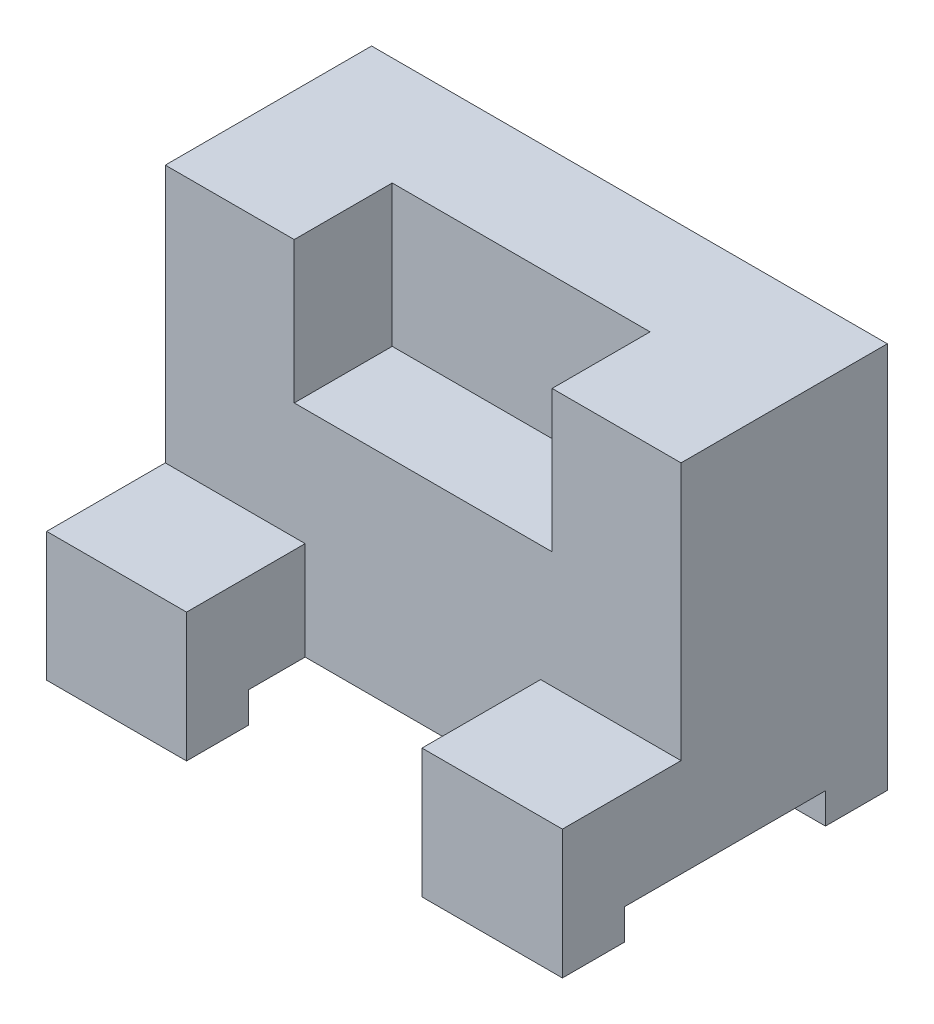
from build123d import *

# Parameters (mm, degrees)
SKETCH1_W             = 27.120418848
SKETCH1_H             = 25
BOSS_EXTRUDE2_DEPTH   = 63
SKETCH1_W_2           = 27.22513089
BOSS_EXTRUDE2_2_DEPTH = 63
BOSS_EXTRUDE3_DEPTH   = 40
SKETCH1_6_W           = 50
SKETCH1_6_H           = 27.434554974
BOSS_EXTRUDE4_DEPTH   = 40
CUT_EXTRUDE1_START    = 40
SKETCH1_7_W           = 50
SKETCH1_7_H           = 27.434554974
CUT_EXTRUDE1_DEPTH    = 19
SKETCH2_W             = 39
SKETCH2_H             = 5.946926335
CUT_EXTRUDE2_DEPTH    = 140.978569788


with BuildPart() as part:
    # Sketch1 → Boss-Extrude2 (new body)
    with BuildSketch(Plane.XY):
        with Locations((13.560209424, 12.5)):
            Rectangle(SKETCH1_W, SKETCH1_H)
    extrude(amount=BOSS_EXTRUDE2_DEPTH)



with BuildPart() as body_2:
    # Sketch1 → Boss-Extrude2 2 (new body)
    with BuildSketch(Plane.XY):
        with Locations((86.387434555, 12.5)):
            Rectangle(SKETCH1_W_2, SKETCH1_H)
    extrude(amount=BOSS_EXTRUDE2_2_DEPTH)


with BuildPart() as part_1:
    add(part.part)

    add(body_2.part)  # Boss-Extrude3 merges body 2
    # Sketch1<5> → Boss-Extrude3 (add)
    with BuildSketch(Plane.XY):
        Polygon((27.120418848, 25), (27.120418848, 0), (72.77486911, 0), (72.77486911, 25), (100, 25), (100, 75), (75, 75), (75, 47.565445026), (25, 47.565445026), (25, 75), (0, 75), (0, 25), align=None)
    extrude(amount=BOSS_EXTRUDE3_DEPTH)

    # Sketch1<6> → Boss-Extrude4 (add)
    with BuildSketch(Plane.XY):
        with Locations((50, 61.282722513)):
            Rectangle(SKETCH1_6_W, SKETCH1_6_H)
    extrude(amount=BOSS_EXTRUDE4_DEPTH)

    # Sketch1<7> → Cut-Extrude1 (cut)
    with BuildSketch(Plane.XY.offset(CUT_EXTRUDE1_START)):
        with Locations((50, 61.282722513)):
            Rectangle(SKETCH1_7_W, SKETCH1_7_H)
    extrude(amount=-CUT_EXTRUDE1_DEPTH, mode=Mode.SUBTRACT)

    # Sketch2 → Cut-Extrude2 (cut, through all)
    with BuildSketch(Plane.ZY):
        with Locations((31.5, 2.973463168)):
            Rectangle(SKETCH2_W, SKETCH2_H)
    extrude(amount=-CUT_EXTRUDE2_DEPTH, mode=Mode.SUBTRACT)


solid = part_1.part
